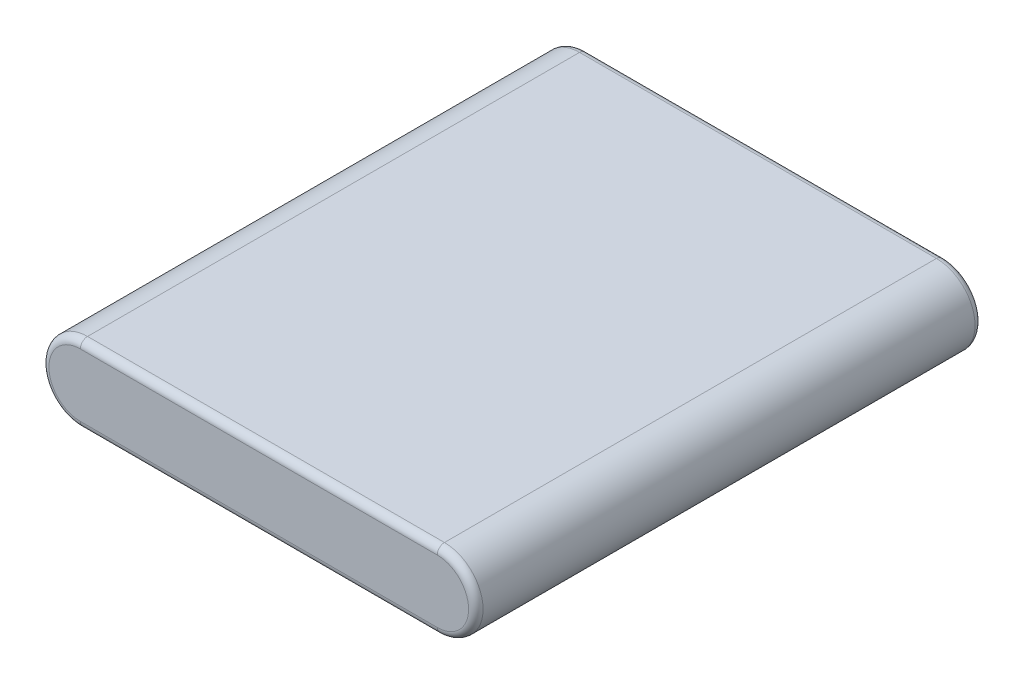
from build123d import *

# Parameters (mm, degrees)
EXTRUDE1_DEPTH = 52.5
FILLET1_R      = 1.5


with BuildPart() as part:
    # Sketch1 → Extrude1 (new, symmetric)
    with BuildSketch(Plane.XY):
        with BuildLine():
            Line((37, -8), (-37, -8))
            ThreePointArc((-37, -8), (-45, 0), (-37, 8))
            Line((-37, 8), (37, 8))
            ThreePointArc((37, 8), (45, 0), (37, -8))
        make_face()
    extrude(amount=EXTRUDE1_DEPTH, both=True)

    # Fillet1
    fillet1_edges = [part.edges().sort_by_distance(p)[0] for p in [
        (-45, 0, 52.5),
        (0, -8, 52.5),
        (45, 0, 52.5),
        (0, -8, -52.5),
        (-45, 0, -52.5),
        (0, 8, -52.5),
        (45, 0, -52.5),
        (0, 8, 52.5),
    ]]
    fillet(fillet1_edges, radius=FILLET1_R)


solid = part.part
